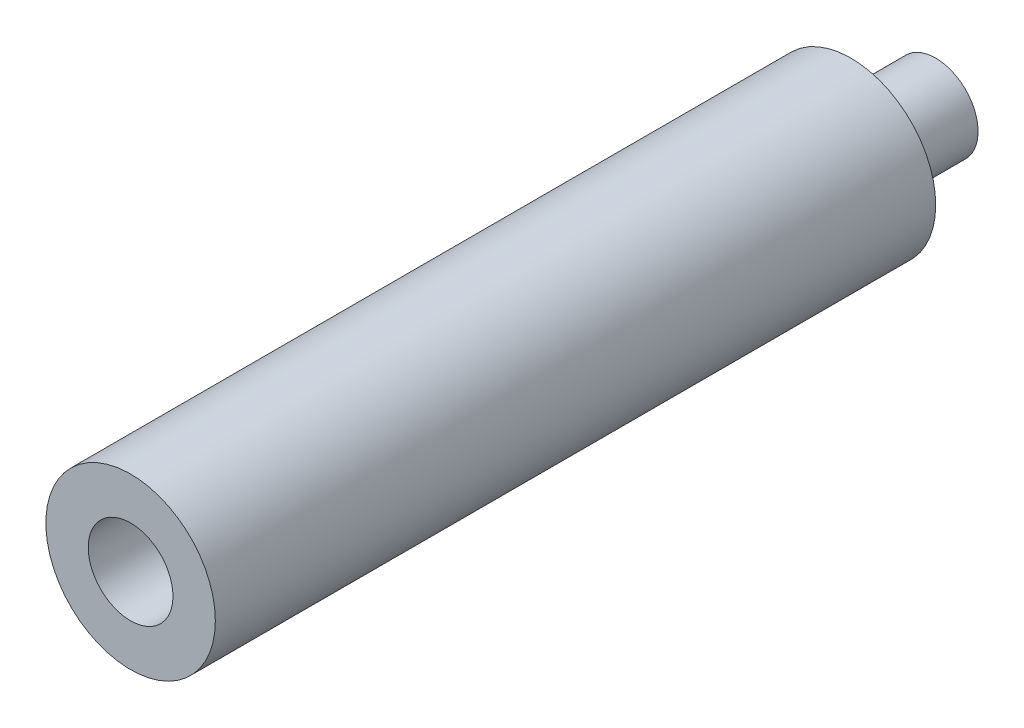
from build123d import *

# Parameters (mm, degrees)
SKETCH_1_R          = 20
EXTRUDE_1_DEPTH     = 170
SKETCH_2_R          = 10
EXTRUDE_2_DEPTH     = 20
SKETCH_3_R          = 10
CUT_EXTRUDE_1_DEPTH = 20


with BuildPart() as part:
    # 스케치1 → 보스-돌출1 (new body)
    with BuildSketch(Plane.XY):
        Circle(SKETCH_1_R)
    extrude(amount=EXTRUDE_1_DEPTH)

    # 스케치2 → 보스-돌출2 (add)
    with BuildSketch(Plane(origin=(0, 0, 0), x_dir=(-1, 0, 0), z_dir=(0, 0, -1))):
        Circle(SKETCH_2_R)
    extrude(amount=EXTRUDE_2_DEPTH)

    # 스케치3 → 컷-돌출1 (cut)
    with BuildSketch(Plane.XY.offset(170)):
        with Locations(Location((0, 0, 0), (0, 0, 180))):
            Circle(SKETCH_3_R)
    extrude(amount=-CUT_EXTRUDE_1_DEPTH, mode=Mode.SUBTRACT)


solid = part.part
